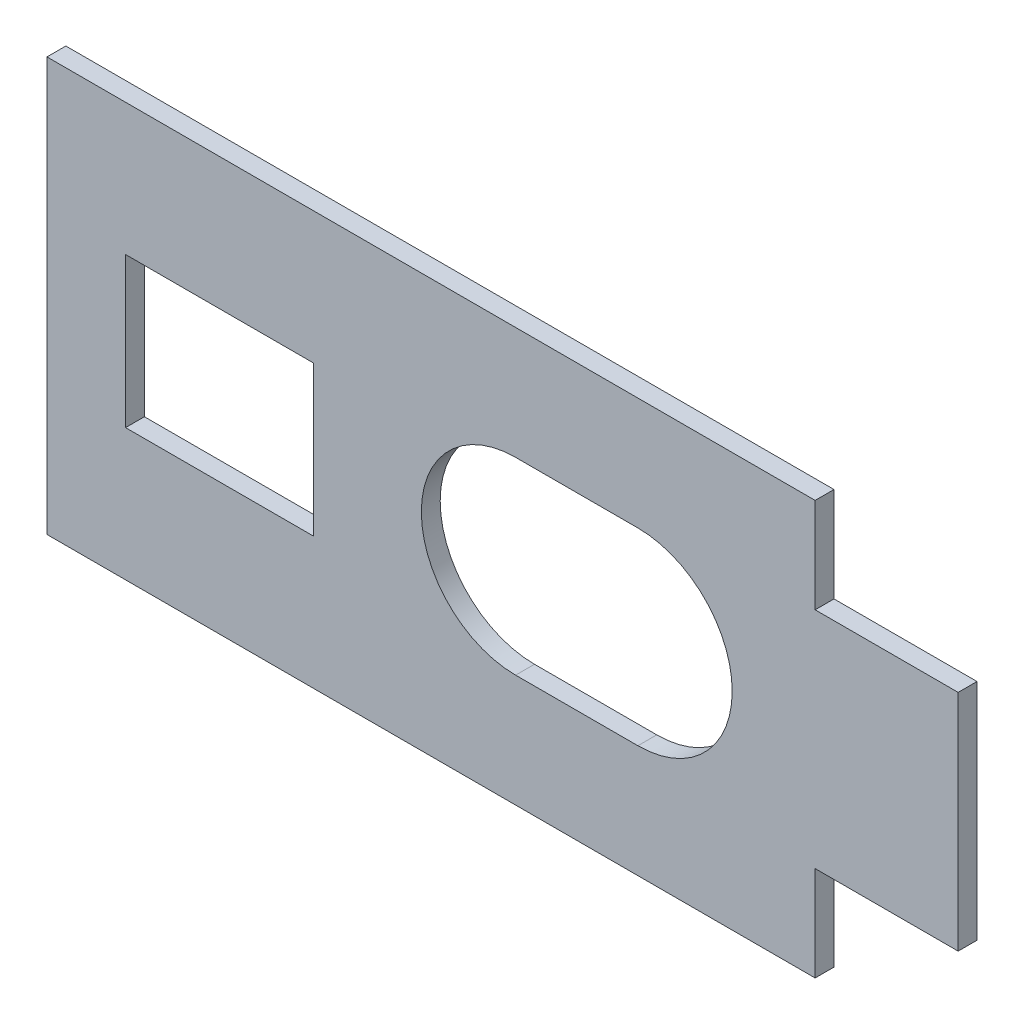
from build123d import *

# Parameters (mm, degrees)
BOSS_EXTRUDE2_DEPTH = 0.762


with BuildPart() as part:
    # Sketch1 → Boss-Extrude2 (new body)
    with BuildSketch(Plane.XY.offset(0.762)):
        with BuildLine():
            Line((21.595288772, -19.1309), (-9.44245, -19.1309))
            Line((-9.44245, -19.1309), (-9.44245, -20.7184))
            Line((-9.44245, -20.7184), (14.94155, -20.7184))
            ThreePointArc((14.94155, -20.7184), (16.737601224, -21.462348776), (17.48155, -23.2584))
            Line((17.48155, -23.2584), (17.48155, -25.2015))
            ThreePointArc((17.48155, -25.2015), (18.24355, -27.4875), (17.48155, -29.7735))
            Line((17.48155, -29.7735), (17.48155, -31.7166))
            ThreePointArc((17.48155, -31.7166), (16.737601224, -33.512651224), (14.94155, -34.2566))
            Line((14.94155, -34.2566), (-9.44245, -34.2566))
            Line((-9.44245, -34.2566), (-9.44245, -35.8441))
            Line((-9.44245, -35.8441), (21.595288772, -35.8441))
            Line((21.595288772, -35.8441), (21.595288772, -32.01505))
            Line((21.595288772, -32.01505), (27.373788772, -32.01505))
            Line((27.373788772, -32.01505), (27.373788772, -22.95995))
            Line((27.373788772, -22.95995), (26.103788772, -22.95995))
            Line((26.103788772, -22.95995), (21.595288772, -22.95995))
            Line((21.595288772, -22.95995), (21.595288772, -19.1309))
        make_face()
        with BuildLine():
            Line((14.94155, -20.7184), (-9.44245, -20.7184))
            Line((-9.44245, -20.7184), (-9.44245, -34.2566))
            Line((-9.44245, -34.2566), (14.94155, -34.2566))
            ThreePointArc((14.94155, -34.2566), (16.737601224, -33.512651224), (17.48155, -31.7166))
            Line((17.48155, -31.7166), (17.48155, -29.7735))
            ThreePointArc((17.48155, -29.7735), (16.137433799, -30.895267598), (14.43355, -31.2975))
            Line((14.43355, -31.2975), (9.49325, -31.2975))
            ThreePointArc((9.49325, -31.2975), (7.419008087, -30.683375543), (6.01345, -29.03898057))
            Line((6.01345, -29.03898057), (6.01345, -30.44025))
            Line((6.01345, -30.44025), (1.32715, -30.44025))
            Line((1.32715, -30.44025), (1.32715, -30.51645))
            Line((1.32715, -30.51645), (-6.26745, -30.51645))
            Line((-6.26745, -30.51645), (-6.26745, -24.45855))
            Line((-6.26745, -24.45855), (1.32715, -24.45855))
            Line((1.32715, -24.45855), (1.32715, -24.53475))
            Line((1.32715, -24.53475), (6.01345, -24.53475))
            Line((6.01345, -24.53475), (6.01345, -25.93601943))
            ThreePointArc((6.01345, -25.93601943), (7.419008087, -24.291624457), (9.49325, -23.6775))
            Line((9.49325, -23.6775), (14.43355, -23.6775))
            ThreePointArc((14.43355, -23.6775), (16.137433799, -24.079732402), (17.48155, -25.2015))
            Line((17.48155, -25.2015), (17.48155, -23.2584))
            ThreePointArc((17.48155, -23.2584), (16.737601224, -21.462348776), (14.94155, -20.7184))
        make_face()
        with BuildLine():
            ThreePointArc((6.01345, -29.03898057), (5.68325, -27.4875), (6.01345, -25.93601943))
            Line((6.01345, -25.93601943), (6.01345, -24.53475))
            Line((6.01345, -24.53475), (1.32715, -24.53475))
            Line((1.32715, -24.53475), (1.32715, -30.44025))
            Line((1.32715, -30.44025), (6.01345, -30.44025))
            Line((6.01345, -30.44025), (6.01345, -29.03898057))
        make_face()
    extrude(amount=BOSS_EXTRUDE2_DEPTH)


solid = part.part
